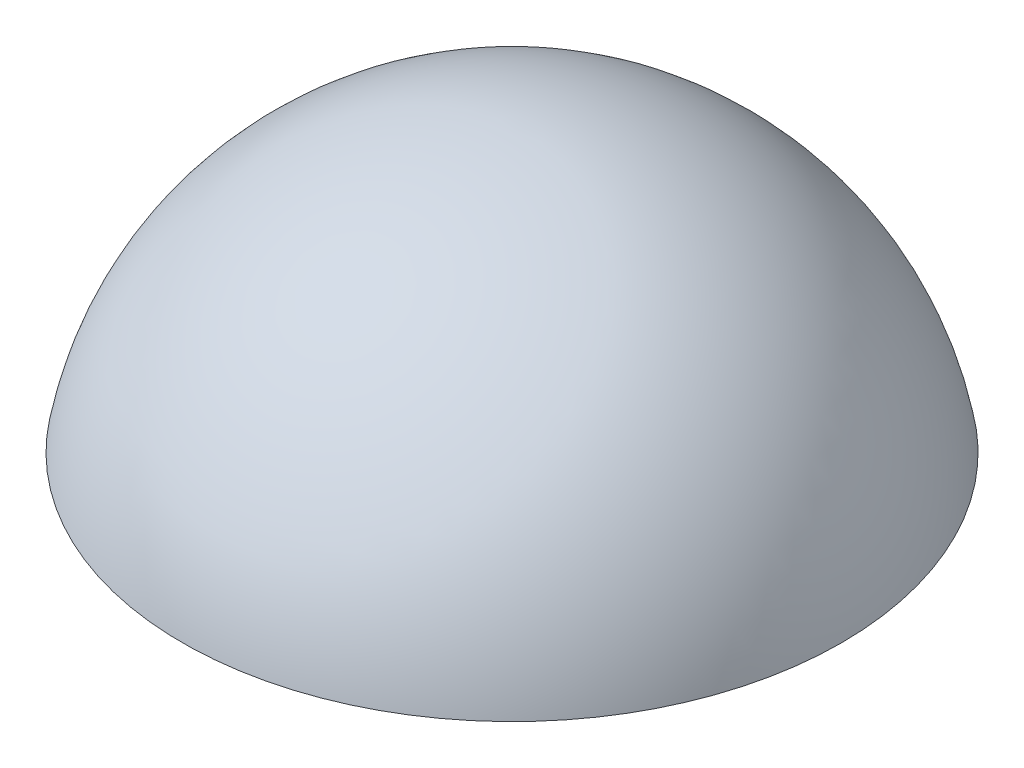
from build123d import *

# Parameters (mm, degrees)
SHELL1_T                = 3
CUT_EXTRUDE1_REACH      = 58.582
CUT_EXTRUDE1_END_RADIUS = 33
SKETCH2_R               = 10


with BuildPart() as part:
    # Sketch1 → Revolve1 (revolve)
    with BuildSketch(Plane.XY):
        with BuildLine():
            Line((0, 30), (0, 5.72))
            Line((0, 5.72), (29.449645159, 5.72))
            ThreePointArc((29.449645159, 5.72), (19.084024733, 23.14735406), (0, 30))
        make_face()
    revolve(axis=Axis((0, 30, 0), (0, -1, 0)))

    # Shell1
    shell1_openings = [part.faces().sort_by_distance(p)[0] for p in [
        (0, 5.72, 0),
    ]]
    offset(amount=SHELL1_T, openings=shell1_openings, kind=Kind.INTERSECTION)

    # Cut-Extrude1: up to this sphere (the profile starts inside it)
    cut_extrude1_end = Location((0, 0, 0)) * Sphere(CUT_EXTRUDE1_END_RADIUS, mode=Mode.PRIVATE)
    # Sketch2 → Cut-Extrude1 (cut, up to the surface)
    with BuildSketch(Plane(origin=(0, 0, 0), x_dir=(0, 0, -1), z_dir=(1, 0, 0)), mode=Mode.PRIVATE) as cut_extrude1_sk1:
        Circle(SKETCH2_R)
    cut_extrude1_tool1 = extrude(cut_extrude1_sk1.sketch, amount=-CUT_EXTRUDE1_REACH, mode=Mode.PRIVATE) & cut_extrude1_end
    add(cut_extrude1_tool1.solids().sort_by_distance((0, 0, 0))[0], mode=Mode.SUBTRACT)


solid = part.part
